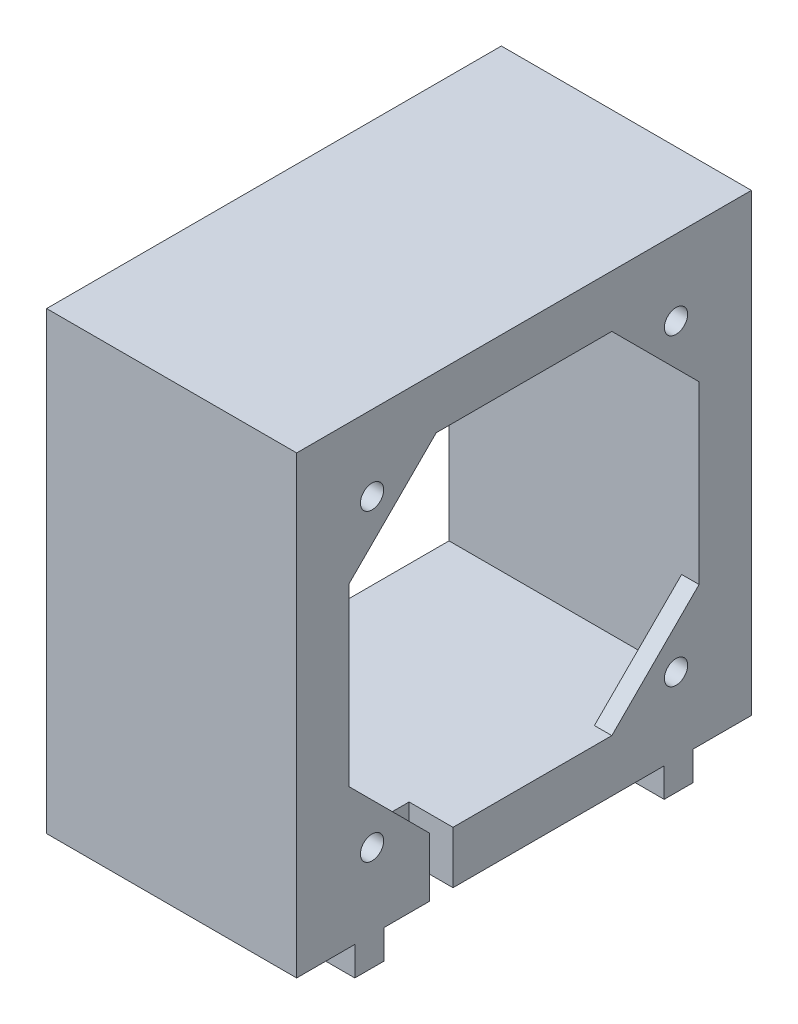
from build123d import *

# Parameters (mm, degrees)
SKETCH1_W           = 78.2
SKETCH1_H           = 78.2
SKETCH1_W_2         = 60.2
SKETCH1_H_2         = 60.2
BOSS_EXTRUDE1_DEPTH = 40
SKETCH2_W           = 78.2
SKETCH2_H           = 78.2
SKETCH2_R           = 2
BOSS_EXTRUDE2_DEPTH = 3
SKETCH3_W           = 15.098438038
SKETCH3_H           = 4
CUT_EXTRUDE1_DEPTH  = 19
SKETCH4_R           = 4.1
CUT_EXTRUDE2_DEPTH  = 1.1
SKETCH5_W           = 30
SKETCH5_H           = 5
BOSS_EXTRUDE3_DEPTH = 5


with BuildPart() as part:
    # Sketch1 → Boss-Extrude1 (new body)
    with BuildSketch(Plane(origin=(0, 0, 0), x_dir=(0, 0, -1), z_dir=(1, 0, 0))):
        Rectangle(SKETCH1_W, SKETCH1_H)
        Rectangle(SKETCH1_W_2, SKETCH1_H_2, mode=Mode.SUBTRACT)
    extrude(amount=BOSS_EXTRUDE1_DEPTH)

    # Sketch2 → Boss-Extrude2 (add)
    # profile 1 of 6: a face of its own
    with BuildSketch(Plane(origin=(40, 0, 0), x_dir=(0, 0, -1), z_dir=(1, 0, 0))):
        Rectangle(SKETCH2_W, SKETCH2_H)
        Polygon((-30.1, 15.1), (-30.1, 30.1), (-15.1, 30.1), (15.1, 30.1), (30.1, 30.1), (30.1, 15.1), (30.1, -15.1), (30.1, -30.1), (15.1, -30.1), (-15.1, -30.1), (-30.1, -30.1), (-30.1, -15.1), align=None, mode=Mode.SUBTRACT)
    # profile 2 of 6: a face of its own
    with BuildSketch(Plane(origin=(40, 0, 0), x_dir=(0, 0, -1), z_dir=(1, 0, 0))):
        Polygon((-15.1, -30.1), (-30.1, -15.1), (-30.1, -30.1), align=None)
        with Locations((-26.135533906, -26.135533906)):
            Circle(SKETCH2_R, mode=Mode.SUBTRACT)
    # profile 3 of 6: a face of its own
    with BuildSketch(Plane(origin=(40, 0, 0), x_dir=(0, 0, -1), z_dir=(1, 0, 0))):
        Polygon((30.1, -15.1), (15.1, -30.1), (30.1, -30.1), align=None)
        with Locations((26.135533906, -26.135533906)):
            Circle(SKETCH2_R, mode=Mode.SUBTRACT)
    # profile 4 of 6: a face of its own
    with BuildSketch(Plane(origin=(40, 0, 0), x_dir=(0, 0, -1), z_dir=(1, 0, 0))):
        Polygon((30.1, 30.1), (15.1, 30.1), (30.1, 15.1), align=None)
        with Locations((26.135533906, 26.135533906)):
            Circle(SKETCH2_R, mode=Mode.SUBTRACT)
    # profile 5 of 6: a face of its own
    with BuildSketch(Plane(origin=(40, 0, 0), x_dir=(0, 0, -1), z_dir=(1, 0, 0))):
        with BuildLine():
            Line((-15.1, 30.1), (-30.1, 30.1))
            Line((-30.1, 30.1), (-27.549747468, 27.549747468))
            ThreePointArc((-27.549747468, 27.549747468), (-25.370167041, 27.983292971), (-24.135533906, 26.135533906))
            ThreePointArc((-24.135533906, 26.135533906), (-24.287774841, 25.370167041), (-24.721320344, 24.721320344))
            Line((-24.721320344, 24.721320344), (-22.6, 22.6))
            Line((-22.6, 22.6), (-15.1, 30.1))
        make_face()
    # profile 6 of 6: a face of its own
    with BuildSketch(Plane(origin=(40, 0, 0), x_dir=(0, 0, -1), z_dir=(1, 0, 0))):
        with BuildLine():
            Line((-27.549747468, 27.549747468), (-30.1, 30.1))
            Line((-30.1, 30.1), (-30.1, 15.1))
            Line((-30.1, 15.1), (-22.6, 22.6))
            Line((-22.6, 22.6), (-24.721320344, 24.721320344))
            ThreePointArc((-24.721320344, 24.721320344), (-27.549747468, 24.721320344), (-27.549747468, 27.549747468))
        make_face()
    extrude(amount=BOSS_EXTRUDE2_DEPTH)

    # Sketch3 → Cut-Extrude1 (cut, symmetric)
    with BuildSketch(Plane(origin=(0, -30.1, 0), x_dir=(1, 0, 0), z_dir=(0, 1, 0))):
        with Locations((43, -14.215479316)):
            Rectangle(SKETCH3_W, SKETCH3_H)
    extrude(amount=CUT_EXTRUDE1_DEPTH, both=True, mode=Mode.SUBTRACT)

    # Sketch4 → Cut-Extrude2 (cut, symmetric)
    with BuildSketch(Plane.ZY):
        with Locations((-34.6, 34.6)):
            Circle(SKETCH4_R)
        with Locations((-34.6, -34.6)):
            Circle(SKETCH4_R)
        with Locations((34.6, -34.6)):
            Circle(SKETCH4_R)
        with BuildLine():
            ThreePointArc((37.499137803, 37.499137803), (31.700862197, 37.499137803), (31.700862197, 31.700862197))
            Line((31.700862197, 31.700862197), (37.499137803, 37.499137803))
        make_face()
        with BuildLine():
            Line((37.499137803, 37.499137803), (31.700862197, 31.700862197))
            ThreePointArc((31.700862197, 31.700862197), (36.169002073, 30.812093917), (38.7, 34.6))
            ThreePointArc((38.7, 34.6), (38.387906083, 36.169002073), (37.499137803, 37.499137803))
        make_face()
    extrude(amount=CUT_EXTRUDE2_DEPTH, both=True, mode=Mode.SUBTRACT)

    # Sketch5 → Boss-Extrude3 (add)
    with BuildSketch(Plane.XZ.offset(39.1)):
        with Locations((28, -26.6)):
            Rectangle(SKETCH5_W, SKETCH5_H)
        with Locations((28, 26.6)):
            Rectangle(SKETCH5_W, SKETCH5_H)
    extrude(amount=BOSS_EXTRUDE3_DEPTH)


solid = part.part
